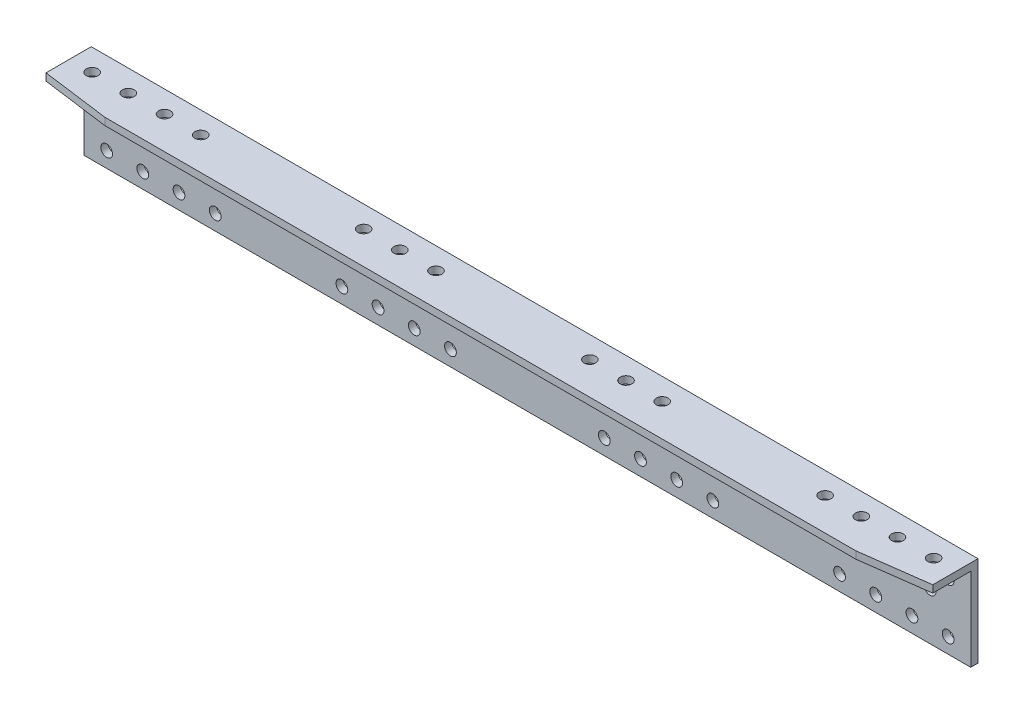
from build123d import *

# Parameters (mm, degrees)
SKETCH_1_W          = 1960
SKETCH_1_H          = 200
SKETCH_1_R          = 13
EXTRUDE_1566_DEPTH  = 16
SKETCH_2_W          = 1960
SKETCH_2_H          = 16
EXTRUDE_1_DEPTH     = 104
SKETCH_3_R          = 13
CUT_EXTRUDE_1_DEPTH = 1008.372820757


with BuildPart() as part:
    # 草图1 → Extrude 1566 (new body)
    with BuildSketch(Plane.XY):
        with Locations((0, 100)):
            Rectangle(SKETCH_1_W, SKETCH_1_H)
        with Locations((930, 146)):
            Circle(SKETCH_1_R, mode=Mode.SUBTRACT)
        with Locations(Location((-890, 106, 0), (0, 0, 180))):
            Circle(SKETCH_1_R, mode=Mode.SUBTRACT)
        with Locations((850, 146)):
            Circle(SKETCH_1_R, mode=Mode.SUBTRACT)
        with Locations((930, 34)):
            Circle(SKETCH_1_R, mode=Mode.SUBTRACT)
        with Locations((850, 34)):
            Circle(SKETCH_1_R, mode=Mode.SUBTRACT)
        with Locations(Location((-810, 106, 0), (0, 0, 180))):
            Circle(SKETCH_1_R, mode=Mode.SUBTRACT)
        with Locations((770, 34)):
            Circle(SKETCH_1_R, mode=Mode.SUBTRACT)
        with Locations((770, 146)):
            Circle(SKETCH_1_R, mode=Mode.SUBTRACT)
        with Locations(Location((-730, 106, 0), (0, 0, 180))):
            Circle(SKETCH_1_R, mode=Mode.SUBTRACT)
        with Locations((690, 146)):
            Circle(SKETCH_1_R, mode=Mode.SUBTRACT)
        with Locations((690, 34)):
            Circle(SKETCH_1_R, mode=Mode.SUBTRACT)
        with Locations(Location((-650, 106, 0), (0, 0, 180))):
            Circle(SKETCH_1_R, mode=Mode.SUBTRACT)
        with Locations(Location((170, 146, 0), (0, 0, 180))):
            Circle(SKETCH_1_R, mode=Mode.SUBTRACT)
        with Locations(Location((170, 34, 0), (0, 0, 180))):
            Circle(SKETCH_1_R, mode=Mode.SUBTRACT)
        with Locations(Location((-410, 146, 0), (0, 0, 180))):
            Circle(SKETCH_1_R, mode=Mode.SUBTRACT)
        with Locations(Location((250, 34, 0), (0, 0, 180))):
            Circle(SKETCH_1_R, mode=Mode.SUBTRACT)
        with Locations(Location((250, 146, 0), (0, 0, 180))):
            Circle(SKETCH_1_R, mode=Mode.SUBTRACT)
        with Locations(Location((-450, 106, 0), (0, 0, 180))):
            Circle(SKETCH_1_R, mode=Mode.SUBTRACT)
        with Locations(Location((330, 34, 0), (0, 0, 180))):
            Circle(SKETCH_1_R, mode=Mode.SUBTRACT)
        with Locations(Location((330, 146, 0), (0, 0, 180))):
            Circle(SKETCH_1_R, mode=Mode.SUBTRACT)
        with Locations(Location((-370, 106, 0), (0, 0, 180))):
            Circle(SKETCH_1_R, mode=Mode.SUBTRACT)
        with Locations(Location((-290, 106, 0), (0, 0, 180))):
            Circle(SKETCH_1_R, mode=Mode.SUBTRACT)
        with Locations(Location((-210, 106, 0), (0, 0, 180))):
            Circle(SKETCH_1_R, mode=Mode.SUBTRACT)
        with Locations((890, 106)):
            Circle(SKETCH_1_R, mode=Mode.SUBTRACT)
        with Locations((810, 106)):
            Circle(SKETCH_1_R, mode=Mode.SUBTRACT)
        with Locations((650, 106)):
            Circle(SKETCH_1_R, mode=Mode.SUBTRACT)
        with Locations((730, 106)):
            Circle(SKETCH_1_R, mode=Mode.SUBTRACT)
        with Locations((-330, 146)):
            Circle(SKETCH_1_R, mode=Mode.SUBTRACT)
        with Locations((-330, 34)):
            Circle(SKETCH_1_R, mode=Mode.SUBTRACT)
        with Locations((410, 146)):
            Circle(SKETCH_1_R, mode=Mode.SUBTRACT)
        with Locations((-250, 146)):
            Circle(SKETCH_1_R, mode=Mode.SUBTRACT)
        with Locations((-250, 34)):
            Circle(SKETCH_1_R, mode=Mode.SUBTRACT)
        with Locations((450, 106)):
            Circle(SKETCH_1_R, mode=Mode.SUBTRACT)
        with Locations((-170, 34)):
            Circle(SKETCH_1_R, mode=Mode.SUBTRACT)
        with Locations((-170, 146)):
            Circle(SKETCH_1_R, mode=Mode.SUBTRACT)
        with Locations((370, 106)):
            Circle(SKETCH_1_R, mode=Mode.SUBTRACT)
        with Locations(Location((-690, 146, 0), (0, 0, 180))):
            Circle(SKETCH_1_R, mode=Mode.SUBTRACT)
        with Locations((290, 106)):
            Circle(SKETCH_1_R, mode=Mode.SUBTRACT)
        with Locations(Location((-770, 146, 0), (0, 0, 180))):
            Circle(SKETCH_1_R, mode=Mode.SUBTRACT)
        with Locations((210, 106)):
            Circle(SKETCH_1_R, mode=Mode.SUBTRACT)
        with Locations(Location((-850, 146, 0), (0, 0, 180))):
            Circle(SKETCH_1_R, mode=Mode.SUBTRACT)
        with Locations((130, 106)):
            Circle(SKETCH_1_R, mode=Mode.SUBTRACT)
        with Locations(Location((-930, 146, 0), (0, 0, 180))):
            Circle(SKETCH_1_R, mode=Mode.SUBTRACT)
        with Locations(Location((-690, 34, 0), (0, 0, 180))):
            Circle(SKETCH_1_R, mode=Mode.SUBTRACT)
        with Locations(Location((-770, 34, 0), (0, 0, 180))):
            Circle(SKETCH_1_R, mode=Mode.SUBTRACT)
        with Locations(Location((-850, 34, 0), (0, 0, 180))):
            Circle(SKETCH_1_R, mode=Mode.SUBTRACT)
        with Locations(Location((-930, 34, 0), (0, 0, 180))):
            Circle(SKETCH_1_R, mode=Mode.SUBTRACT)
        with Locations(Location((-130, 106, 0), (0, 0, 180))):
            Circle(SKETCH_1_R, mode=Mode.SUBTRACT)
        with Locations((410, 34)):
            Circle(SKETCH_1_R, mode=Mode.SUBTRACT)
        with Locations(Location((-410, 34, 0), (0, 0, 180))):
            Circle(SKETCH_1_R, mode=Mode.SUBTRACT)
    extrude(amount=EXTRUDE_1566_DEPTH)

    # 草图2 → 凸台-拉伸1 (add)
    with BuildSketch(Plane.XY.offset(16)):
        with Locations((0, 192)):
            Rectangle(SKETCH_2_W, SKETCH_2_H)
    extrude(amount=EXTRUDE_1_DEPTH)

    # 草图3 → 切除-拉伸1 (cut, through all)
    with BuildSketch(Plane(origin=(0, 200, 0), x_dir=(-1, 0, 0), z_dir=(0, 1, 0))):
        with Locations(Location((-930, 48, 0), (0, 0, 90))):
            Circle(SKETCH_3_R)
        with Locations(Location((-850, 48, 0), (0, 0, 90))):
            Circle(SKETCH_3_R)
        with Locations(Location((-770, 48, 0), (0, 0, 90))):
            Circle(SKETCH_3_R)
        with Locations(Location((-690, 48, 0), (0, 0, 90))):
            Circle(SKETCH_3_R)
        with Locations(Location((-330, 48, 0), (0, 0, 90))):
            Circle(SKETCH_3_R)
        with Locations(Location((-250, 48, 0), (0, 0, 90))):
            Circle(SKETCH_3_R)
        with Locations(Location((-170, 48, 0), (0, 0, 90))):
            Circle(SKETCH_3_R)
        with Locations(Location((170, 48, 0), (0, 0, 90))):
            Circle(SKETCH_3_R)
        with Locations(Location((250, 48, 0), (0, 0, 90))):
            Circle(SKETCH_3_R)
        with Locations(Location((330, 48, 0), (0, 0, 90))):
            Circle(SKETCH_3_R)
        with Locations(Location((930, 48, 0), (0, 0, 90))):
            Circle(SKETCH_3_R)
        with Locations(Location((850, 48, 0), (0, 0, 90))):
            Circle(SKETCH_3_R)
        with Locations(Location((770, 48, 0), (0, 0, 90))):
            Circle(SKETCH_3_R)
        with Locations(Location((690, 48, 0), (0, 0, 90))):
            Circle(SKETCH_3_R)
        Polygon((-980, 100), (-830, 120), (-980, 120), align=None)
        Polygon((980, 100), (830, 120), (980, 120), align=None)
    extrude(amount=-CUT_EXTRUDE_1_DEPTH, mode=Mode.SUBTRACT)


solid = part.part
